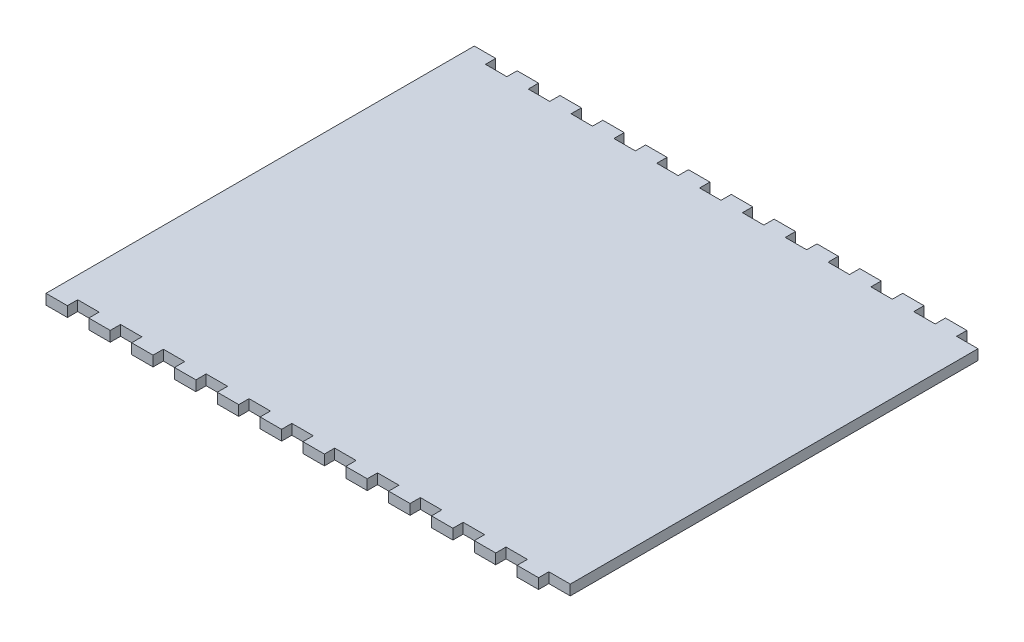
from build123d import *

# Parameters (mm, degrees)
SKETCH1_W           = 152.4
SKETCH1_H           = 127
BOSS_EXTRUDE1_DEPTH = 3.048
SKETCH2_W           = 6.35
SKETCH2_H           = 3.048
CUT_EXTRUDE1_DEPTH  = 100.236990603


with BuildPart() as part:
    # Sketch1 → Boss-Extrude1 (new body)
    with BuildSketch(Plane(origin=(0, 0, 0), x_dir=(1, 0, 0), z_dir=(0, 1, 0))):
        Rectangle(SKETCH1_W, SKETCH1_H)
    extrude(amount=BOSS_EXTRUDE1_DEPTH)

    # Sketch2 → Cut-Extrude1 (cut, through all)
    with BuildSketch(Plane(origin=(0, 3.048, 0), x_dir=(1, 0, 0), z_dir=(0, 1, 0))):
        with Locations((-66.675, -61.976)):
            Rectangle(SKETCH2_W, SKETCH2_H)
        with Locations((-53.975, -61.976)):
            Rectangle(SKETCH2_W, SKETCH2_H)
        with Locations((-41.275, -61.976)):
            Rectangle(SKETCH2_W, SKETCH2_H)
        with Locations((-28.575, -61.976)):
            Rectangle(SKETCH2_W, SKETCH2_H)
        with Locations((-15.875, -61.976)):
            Rectangle(SKETCH2_W, SKETCH2_H)
        with Locations((-3.175, -61.976)):
            Rectangle(SKETCH2_W, SKETCH2_H)
        with Locations((9.525, -61.976)):
            Rectangle(SKETCH2_W, SKETCH2_H)
        with Locations((22.225, -61.976)):
            Rectangle(SKETCH2_W, SKETCH2_H)
        with Locations((47.625, -61.976)):
            Rectangle(SKETCH2_W, SKETCH2_H)
        with Locations((60.325, -61.976)):
            Rectangle(SKETCH2_W, SKETCH2_H)
        with Locations((34.925, -61.976)):
            Rectangle(SKETCH2_W, SKETCH2_H)
        with Locations((73.025, -61.976)):
            Rectangle(SKETCH2_W, SKETCH2_H)
        with Locations((-66.675, 61.976)):
            Rectangle(SKETCH2_W, SKETCH2_H)
        with Locations((-53.975, 61.976)):
            Rectangle(SKETCH2_W, SKETCH2_H)
        with Locations((-41.275, 61.976)):
            Rectangle(SKETCH2_W, SKETCH2_H)
        with Locations((-28.575, 61.976)):
            Rectangle(SKETCH2_W, SKETCH2_H)
        with Locations((-15.875, 61.976)):
            Rectangle(SKETCH2_W, SKETCH2_H)
        with Locations((-3.175, 61.976)):
            Rectangle(SKETCH2_W, SKETCH2_H)
        with Locations((9.525, 61.976)):
            Rectangle(SKETCH2_W, SKETCH2_H)
        with Locations((22.225, 61.976)):
            Rectangle(SKETCH2_W, SKETCH2_H)
        with Locations((34.925, 61.976)):
            Rectangle(SKETCH2_W, SKETCH2_H)
        with Locations((47.625, 61.976)):
            Rectangle(SKETCH2_W, SKETCH2_H)
        with Locations((60.325, 61.976)):
            Rectangle(SKETCH2_W, SKETCH2_H)
        with Locations((73.025, 61.976)):
            Rectangle(SKETCH2_W, SKETCH2_H)
    extrude(amount=-CUT_EXTRUDE1_DEPTH, mode=Mode.SUBTRACT)


solid = part.part
